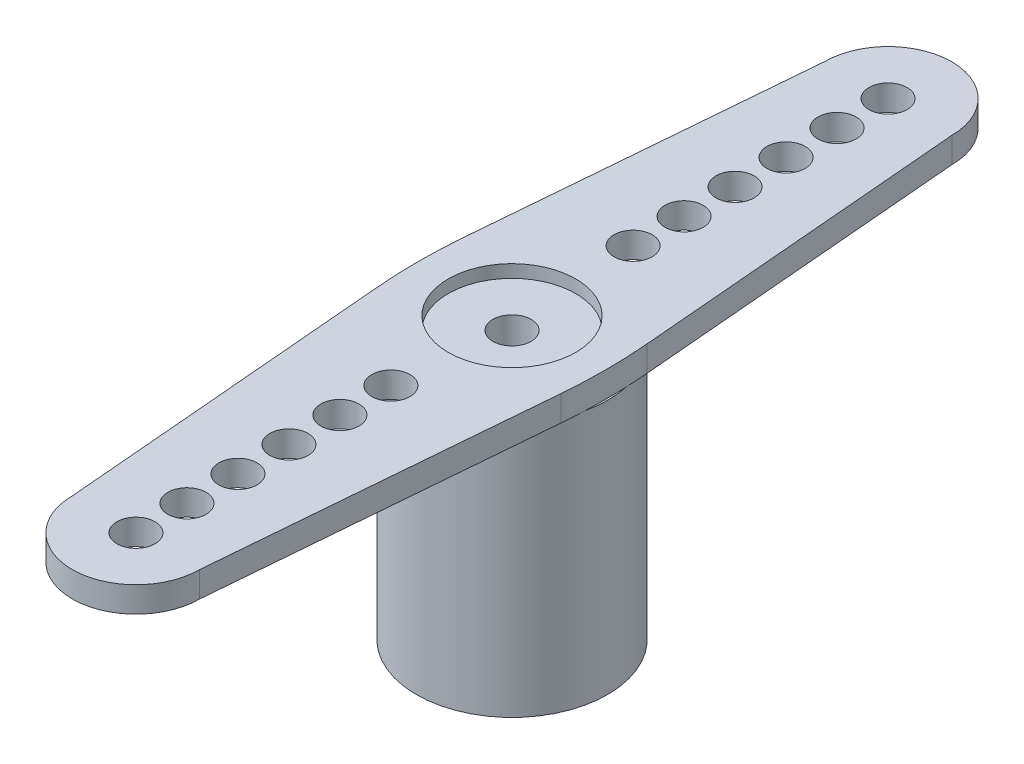
from build123d import *

# Parameters (mm, degrees)
BOSS_EXTRUDE1_DEPTH             = 1
SKETCH2_R                       = 3.75
BOSS_EXTRUDE2_DEPTH             = 10
CUT_EXTRUDE1_DEPTH              = 3
DRAFT1_ANGLE                    = 6.428571429
DRAFT2_ANGLE                    = 6.428571429
DRAFT3_ANGLE                    = 6.428571429
DRAFT4_ANGLE                    = 6.428571429
DRAFT5_ANGLE                    = 6.428571429
DRAFT6_ANGLE                    = 6.428571429
DRAFT7_ANGLE                    = 6.428571429
DRAFT8_ANGLE                    = 6.428571429
F_1_5_1_5_DIAMETER_HOLE1_D      = 1.5
M5X0_8_TAPPED_HOLE1_D           = 1.5
M5X0_8_TAPPED_HOLE1_DEPTH       = 11
M5X0_8_TAPPED_HOLE1_CBORE_D     = 5
M5X0_8_TAPPED_HOLE1_CBORE_DEPTH = 0.5


with BuildPart() as part:
    # Sketch1 → Boss-Extrude1 (new body)
    with BuildSketch(Plane(origin=(0, 1, 0), x_dir=(1, 0, 0), z_dir=(0, 1, 0))):
        with BuildLine():
            Line((-2.5, 14.75), (-3.606876141, 1.688861534))
            ThreePointArc((-3.606876141, 1.688861534), (-3.678310043, 0), (-3.606876141, -1.688861534))
            Line((-3.606876141, -1.688861534), (-2.5, -14.75))
            ThreePointArc((-2.5, -14.75), (0, -17.25), (2.5, -14.75))
            Line((2.5, -14.75), (3.606876141, -1.688861534))
            ThreePointArc((3.606876141, -1.688861534), (3.678310043, 0), (3.606876141, 1.688861534))
            Line((3.606876141, 1.688861534), (2.5, 14.75))
            ThreePointArc((2.5, 14.75), (0, 17.25), (-2.5, 14.75))
        make_face()
    extrude(amount=-BOSS_EXTRUDE1_DEPTH)

    # Sketch2 → Boss-Extrude2 (add)
    with BuildSketch(Plane.XZ):
        with Locations(Location((0, 0, 0), (0, 0, 12.437280395))):
            Circle(SKETCH2_R)
    extrude(amount=BOSS_EXTRUDE2_DEPTH)

    # Sketch3 → Cut-Extrude1 (cut)
    with BuildSketch(Plane.XZ.offset(10)):
        Polygon((0.132515428, 2.359655809), (0, 2.492171237), (-0.132515428, 2.359655809), (-0.279034647, 2.476500987), (-0.395879825, 2.329981768), (-0.554560271, 2.4296873), (-0.654265804, 2.271006854), (-0.823111978, 2.352318886), (-0.90442401, 2.183472712), (-1.081312575, 2.245368698), (-1.14320856, 2.068480133), (-1.325915038, 2.110181695), (-1.367616599, 1.927475217), (-1.574826066, 1.950822117), (-1.574826066, 1.762231181), (-1.762231181, 1.762231181), (-1.762231181, 1.574826066), (-1.950822117, 1.574826066), (-1.927475217, 1.367616599), (-2.110181695, 1.325915038), (-2.068480133, 1.14320856), (-2.245368698, 1.081312575), (-2.183472712, 0.90442401), (-2.352318886, 0.823111978), (-2.271006854, 0.654265804), (-2.4296873, 0.554560271), (-2.329981768, 0.395879825), (-2.476500987, 0.279034647), (-2.359655809, 0.132515428), (-2.492171237, 0), (-2.359655809, -0.132515428), (-2.476500987, -0.279034647), (-2.329981768, -0.395879825), (-2.4296873, -0.554560271), (-2.271006854, -0.654265804), (-2.352318886, -0.823111978), (-2.183472712, -0.90442401), (-2.245368698, -1.081312575), (-2.068480133, -1.14320856), (-2.110181695, -1.325915038), (-1.927475217, -1.367616599), (-1.950822117, -1.574826066), (-1.762231181, -1.574826066), (-1.762231181, -1.762231181), (-1.574826066, -1.762231181), (-1.574826066, -1.950822117), (-1.367616599, -1.927475217), (-1.325915038, -2.110181695), (-1.14320856, -2.068480133), (-1.081312575, -2.245368698), (-0.90442401, -2.183472712), (-0.823111978, -2.352318886), (-0.654265804, -2.271006854), (-0.554560271, -2.4296873), (-0.395879825, -2.329981768), (-0.279034647, -2.476500987), (-0.132515428, -2.359655809), (0, -2.492171237), (0.132515428, -2.359655809), (0.279034647, -2.476500987), (0.395879825, -2.329981768), (0.554560271, -2.4296873), (0.654265804, -2.271006854), (0.823111978, -2.352318886), (0.90442401, -2.183472712), (1.081312575, -2.245368698), (1.14320856, -2.068480133), (1.325915038, -2.110181695), (1.367616599, -1.927475217), (1.574826066, -1.950822117), (1.574826066, -1.762231181), (1.762231181, -1.762231181), (1.762231181, -1.574826066), (1.950822117, -1.574826066), (1.927475217, -1.367616599), (2.110181695, -1.325915038), (2.068480133, -1.14320856), (2.245368698, -1.081312575), (2.183472712, -0.90442401), (2.352318886, -0.823111978), (2.271006854, -0.654265804), (2.4296873, -0.554560271), (2.329981768, -0.395879825), (2.476500987, -0.279034647), (2.359655809, -0.132515428), (2.492171237, 0), (2.359655809, 0.132515428), (2.476500987, 0.279034647), (2.329981768, 0.395879825), (2.4296873, 0.554560271), (2.271006854, 0.654265804), (2.352318886, 0.823111978), (2.183472712, 0.90442401), (2.245368698, 1.081312575), (2.068480133, 1.14320856), (2.110181695, 1.325915038), (1.927475217, 1.367616599), (1.950822117, 1.574826066), (1.762231181, 1.574826066), (1.762231181, 1.762231181), (1.574826066, 1.762231181), (1.574826066, 1.950822117), (1.367616599, 1.927475217), (1.325915038, 2.110181695), (1.14320856, 2.068480133), (1.081312575, 2.245368698), (0.90442401, 2.183472712), (0.823111978, 2.352318886), (0.654265804, 2.271006854), (0.554560271, 2.4296873), (0.395879825, 2.329981768), (0.279034647, 2.476500987), align=None)
    extrude(amount=-CUT_EXTRUDE1_DEPTH, mode=Mode.SUBTRACT)

    # Draft1
    draft1_faces = [part.faces().sort_by_distance(p)[0] for p in [
        (1.856526649, -8.5, 1.574826066),
    ]]
    draft(draft1_faces, Plane(origin=(1.762231181, -7, 1.574826066), x_dir=(0, 0, -1), z_dir=(-1, 0, 0)), DRAFT1_ANGLE)

    # Draft2
    draft2_faces = [part.faces().sort_by_distance(p)[0] for p in [
        (1.574826066, -8.5, 1.856526649),
    ]]
    draft(draft2_faces, Plane(origin=(1.762231181, -7, 1.762231181), x_dir=(-1, 0, 0), z_dir=(0, 0, -1)), DRAFT2_ANGLE)

    # Draft3
    draft3_faces = [part.faces().sort_by_distance(p)[0] for p in [
        (1.574826066, -8.5, -1.856526649),
    ]]
    draft(draft3_faces, Plane(origin=(1.574826066, -7, -1.762231181), x_dir=(1, 0, 0), z_dir=(0, 0, 1)), DRAFT3_ANGLE)

    # Draft4
    draft4_faces = [part.faces().sort_by_distance(p)[0] for p in [
        (1.856526649, -8.5, -1.574826066),
    ]]
    draft(draft4_faces, Plane(origin=(1.762231181, -7, -1.762231181), x_dir=(0, 0, -1), z_dir=(-1, 0, 0)), DRAFT4_ANGLE)

    # Draft5
    draft5_faces = [part.faces().sort_by_distance(p)[0] for p in [
        (-1.856526649, -8.5, -1.574826066),
    ]]
    draft(draft5_faces, Plane(origin=(-1.762231181, -7, -1.574826066), x_dir=(0, 0, 1), z_dir=(1, 0, 0)), DRAFT5_ANGLE)

    # Draft6
    draft6_faces = [part.faces().sort_by_distance(p)[0] for p in [
        (-1.574826066, -8.5, -1.856526649),
    ]]
    draft(draft6_faces, Plane(origin=(-1.762231181, -7, -1.762231181), x_dir=(1, 0, 0), z_dir=(0, 0, 1)), DRAFT6_ANGLE)

    # Draft7
    draft7_faces = [part.faces().sort_by_distance(p)[0] for p in [
        (-1.574826066, -8.5, 1.856526649),
    ]]
    draft(draft7_faces, Plane(origin=(-1.574826066, -7, 1.762231181), x_dir=(-1, 0, 0), z_dir=(0, 0, -1)), DRAFT7_ANGLE)

    # Draft8
    draft8_faces = [part.faces().sort_by_distance(p)[0] for p in [
        (-1.856526649, -8.5, 1.574826066),
    ]]
    draft(draft8_faces, Plane(origin=(-1.762231181, -7, 1.762231181), x_dir=(0, 0, 1), z_dir=(1, 0, 0)), DRAFT8_ANGLE)

    # Ø1.5 (1.5) Diameter Hole1 (through all)
    with Locations(Plane(origin=(0, 0, 0), x_dir=(-1, 0, 0), z_dir=(0, -1, 0))):
        with Locations((0, 14.75), (0, 12.75), (0, 10.75), (0, 8.75), (0, 6.75), (0, 4.75), (0, -4.75), (0, -6.75), (0, -8.75), (0, -10.75), (0, -12.75), (0, -14.75)):
            Hole(F_1_5_1_5_DIAMETER_HOLE1_D / 2)

    # M5x0.8 Tapped Hole1
    with Locations(Plane(origin=(0, 1, 0), x_dir=(1, 0, 0), z_dir=(0, 1, 0))):
        with Locations((0, 0)):
            CounterBoreHole(M5X0_8_TAPPED_HOLE1_D / 2, M5X0_8_TAPPED_HOLE1_CBORE_D / 2, M5X0_8_TAPPED_HOLE1_CBORE_DEPTH, depth=M5X0_8_TAPPED_HOLE1_DEPTH)


solid = part.part
